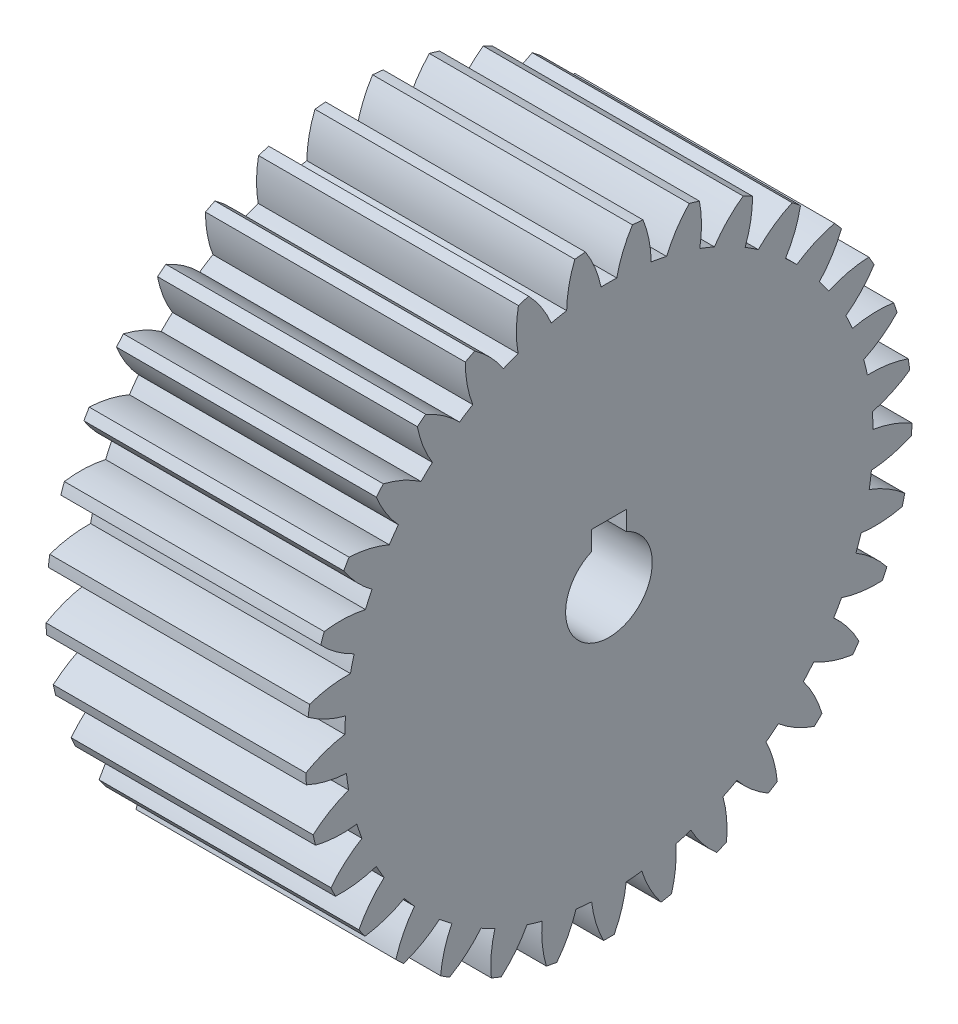
from build123d import *

# Parameters (mm, degrees)
BASPROSKE_W     = 30
BASPROSKE_H     = 35
TOOTHCUT_DEPTH  = 58.879184514
TEETHCUTS_COUNT = 33
TEETHCUTS_ANGLE = 349.090909091
BORSKE_R        = 5
BORE_DEPTH      = 50.0000508
KEYSKE_W        = 4
KEYSKE_H        = 6.8
KEYWAY_DEPTH    = 50.0000508


with BuildPart() as part:
    # BasProSke → Base-Revolve (revolve)
    with BuildSketch(Plane(origin=(0, 0, 0), x_dir=(1, 0, 0), z_dir=(0, 1, 0)), mode=Mode.PRIVATE) as base_revolve_sk:
        with Locations((15, 17.5)):
            Rectangle(BASPROSKE_W, BASPROSKE_H)
    revolve(base_revolve_sk.sketch.rotate(Axis((-10, 0, 0), (1, 0, 0)), 180), axis=Axis((-10, 0, 0), (1, 0, 0)))

    # TooCutSke → ToothCut (cut, through all)
    with BuildSketch(Plane(origin=(0, 0, 0), x_dir=(0, 0, -1), z_dir=(1, 0, 0))):
        with BuildLine():
            ThreePointArc((0.905724209, 30.485548456), (0, 30.499), (-0.905724209, 30.485548456))
            ThreePointArc((-0.905724209, 30.485548456), (-1.615561414, 32.785724392), (-2.731318558, 34.918742018))
            ThreePointArc((-2.731318558, 34.918742018), (0, 35.0254), (2.731318558, 34.918742018))
            ThreePointArc((2.731318558, 34.918742018), (1.615561414, 32.785724392), (0.905724209, 30.485548456))
        make_face()
    toothcut = extrude(amount=TOOTHCUT_DEPTH, mode=Mode.SUBTRACT)

    # TeethCuts: ToothCut ×33 about axis
    teethcuts_axis = Axis((-10, 0, 0), (1, 0, 0))
    for i in range(1, TEETHCUTS_COUNT):
        add(toothcut.rotate(teethcuts_axis, i * TEETHCUTS_ANGLE / (TEETHCUTS_COUNT - 1)), mode=Mode.SUBTRACT)

    # BorSke → Bore (cut, symmetric)
    with BuildSketch(Plane(origin=(0, 0, 0), x_dir=(0, 0, -1), z_dir=(1, 0, 0))):
        with Locations(Location((0, 0, 0), (0, 0, 180))):
            Circle(BORSKE_R)
    extrude(amount=BORE_DEPTH, both=True, mode=Mode.SUBTRACT)

    # KeySke → Keyway (cut, symmetric)
    with BuildSketch(Plane(origin=(0, 0, 0), x_dir=(0, 0, -1), z_dir=(1, 0, 0))):
        with Locations((0, 3.4)):
            Rectangle(KEYSKE_W, KEYSKE_H)
    extrude(amount=KEYWAY_DEPTH, both=True, mode=Mode.SUBTRACT)


solid = part.part
